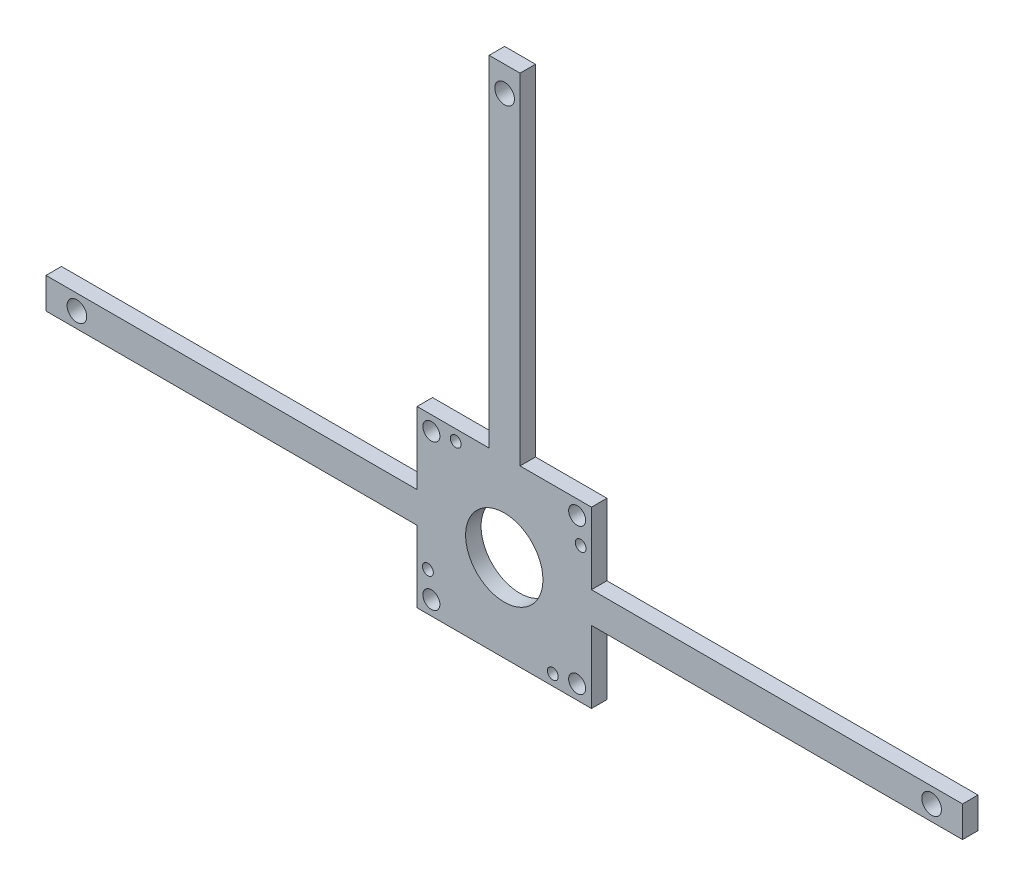
from build123d import *

# Parameters (mm, degrees)
CROQUIS1_R              = 2.75
CROQUIS1_R_2            = 1.75
CROQUIS1_R_3            = 1.747778747
CROQUIS1_R_4            = 7.725412866
SALIENTE_EXTRUIR1_DEPTH = 5
CROQUIS2_R              = 3.175
CROQUIS2_R_2            = 12.5
CORTAR_EXTRUIR1_DEPTH   = 5


with BuildPart() as part:
    # Croquis1 → Saliente-Extruir1 (new body)
    with BuildSketch(Plane.XY):
        Polygon((-28.2, -55.083487529), (-28.2, -31.8), (-4.898409704, -31.8), (-4.898409704, 78.2), (5.101590296, 78.2), (5.101590296, -31.8), (28.2, -31.8), (28.2, -54.916512471), (148.2, -54.916512471), (148.2, -64.916512471), (28.2, -64.916512471), (28.2, -88.2), (-28.2, -88.2), (-28.2, -65.083487529), (-148.2, -65.083487529), (-148.2, -55.083487529), align=None)
        with Locations((-23.57, -36.43)):
            Circle(CROQUIS1_R, mode=Mode.SUBTRACT)
        with Locations((23.57, -36.43)):
            Circle(CROQUIS1_R, mode=Mode.SUBTRACT)
        with Locations((23.57, -83.57)):
            Circle(CROQUIS1_R, mode=Mode.SUBTRACT)
        with Locations((-23.57, -83.57)):
            Circle(CROQUIS1_R, mode=Mode.SUBTRACT)
        with Locations((-15.7, -35.3)):
            Circle(CROQUIS1_R_2, mode=Mode.SUBTRACT)
        with Locations((24.7, -44.3)):
            Circle(CROQUIS1_R_3, mode=Mode.SUBTRACT)
        with Locations((15.7, -84.7)):
            Circle(CROQUIS1_R_2, mode=Mode.SUBTRACT)
        with Locations((-24.7, -75.7)):
            Circle(CROQUIS1_R_2, mode=Mode.SUBTRACT)
        with Locations((0, -60)):
            Circle(CROQUIS1_R_4, mode=Mode.SUBTRACT)
    extrude(amount=SALIENTE_EXTRUIR1_DEPTH)

    # Croquis2 → Cortar-Extruir1 (cut)
    with BuildSketch(Plane.XY.offset(5)):
        with Locations((0.101590296, 70)):
            Circle(CROQUIS2_R)
        with Locations((138.2, -59.916512471)):
            Circle(CROQUIS2_R)
        with Locations((-138.2, -60.083487529)):
            Circle(CROQUIS2_R)
        with Locations((0, -60)):
            Circle(CROQUIS2_R_2)
    extrude(amount=-CORTAR_EXTRUIR1_DEPTH, mode=Mode.SUBTRACT)


solid = part.part
